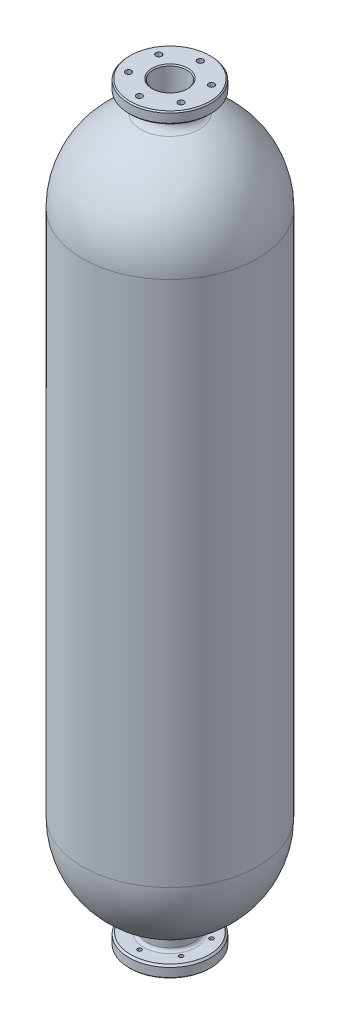
from build123d import *

# Parameters (mm, degrees)
CIRPATTERN1_COUNT = 6


with BuildPart() as part:
    # Sketch2 → Revolve1 (revolve)
    with BuildSketch(Plane.XY, mode=Mode.PRIVATE) as revolve1_sk:
        with BuildLine():
            Line((-150, 450.5), (-150, -450.5))
            ThreePointArc((-150, -450.5), (-122.474487139, -537.102540378), (-50, -591.921356237))
            ThreePointArc((-50, -591.921356237), (-42.752551286, -597.403237823), (-40, -606.063491861))
            Line((-40, -606.063491861), (-40, -617.5))
            ThreePointArc((-40, -617.5), (-41.464466094, -621.035533906), (-45, -622.5))
            Line((-45, -622.5), (-67, -622.5))
            Line((-67, -622.5), (-70, -625.5))
            Line((-70, -625.5), (-70, -640.5))
            Line((-70, -640.5), (-68, -642.5))
            Line((-68, -642.5), (-40, -642.5))
            Line((-40, -642.5), (0, -642.5))
            Line((0, -642.5), (0, -592.5))
            ThreePointArc((0, -592.5), (-100.409162928, -550.909162928), (-142, -450.5))
            Line((-142, -450.5), (-142, 450.5))
            ThreePointArc((-142, 450.5), (-100.409162928, 550.909162928), (0, 592.5))
            Line((0, 592.5), (0, 642.5))
            Line((0, 642.5), (-40, 642.5))
            Line((-40, 642.5), (-68, 642.5))
            Line((-68, 642.5), (-70, 640.5))
            Line((-70, 640.5), (-70, 625.5))
            Line((-70, 625.5), (-67, 622.5))
            Line((-67, 622.5), (-45, 622.5))
            ThreePointArc((-45, 622.5), (-41.464466094, 621.035533906), (-40, 617.5))
            Line((-40, 617.5), (-40, 606.063491861))
            ThreePointArc((-40, 606.063491861), (-42.752551286, 597.403237823), (-50, 591.921356237))
            ThreePointArc((-50, 591.921356237), (-122.474487139, 537.102540378), (-150, 450.5))
        make_face()
    revolve(revolve1_sk.sketch.rotate(Axis((0, 415.469849099, 0), (0, -1, 0)), 270), axis=Axis((0, 415.469849099, 0), (0, -1, 0)))

    # Sketch7 → 3/8 Clearance Hole1 (revolve, cut)
    with BuildSketch(Plane(origin=(0, 642.5, -52), x_dir=(0, 0, 1), z_dir=(1, 0, 0))):
        Polygon((0, 0), (0, 22.079479155), (5.0419, 19.05), (5.0419, 0), align=None)
    f_3_8_clearance_hole1 = revolve(axis=Axis((0, 648.85, -52), (0, -1, 0)), mode=Mode.SUBTRACT)

    # CirPattern1: 3/8 Clearance Hole1 ×6 about axis
    cirpattern1_axis = Axis((0, 0, 0), (0, 1, 0))
    for i in range(1, CIRPATTERN1_COUNT):
        add(f_3_8_clearance_hole1.rotate(cirpattern1_axis, i * 360 / CIRPATTERN1_COUNT), mode=Mode.SUBTRACT)

    # Sketch8 → 2-11-1/2 NPSM Tapped Hole1 (revolve, cut)
    with BuildSketch(Plane(origin=(0, 642.5, 0), x_dir=(0, 0, 1), z_dir=(1, 0, 0))):
        Polygon((0, 0), (0, 209.238270557), (28.6893, 192), (28.6893, 1.8034), (30.4927, 0), align=None)
    f_2_11_1_2_npsm_tapped_hole1 = revolve(axis=Axis((0, 648.85, 0), (0, -1, 0)), mode=Mode.SUBTRACT)

    # Mirror2: 3/8 Clearance Hole1 across plane
    add(f_3_8_clearance_hole1.mirror(Plane.ZX), mode=Mode.SUBTRACT)

    # Mirror2 copy 1 sketch → Mirror2 copy 1 (revolve, cut)
    with BuildSketch(Plane(origin=(-45.033320997, -642.5, -26), x_dir=(0.8660254037844386, 0, 0.5000000000000001), z_dir=(0.5000000000000001, 0, -0.8660254037844386))):
        Polygon((0, 0), (0, -22.079479155), (5.0419, -19.05), (5.0419, 0), align=None)
    revolve(axis=Axis((-45.033320997, -648.85, -26), (0, -1, 0)), mode=Mode.SUBTRACT)

    # Mirror2 copy 2 sketch → Mirror2 copy 2 (revolve, cut)
    with BuildSketch(Plane(origin=(-45.033320997, -642.5, 26), x_dir=(0.8660254037844387, 0, -0.4999999999999998), z_dir=(-0.4999999999999998, 0, -0.8660254037844387))):
        Polygon((0, 0), (0, -22.079479155), (5.0419, -19.05), (5.0419, 0), align=None)
    revolve(axis=Axis((-45.033320997, -648.85, 26), (0, -1, 0)), mode=Mode.SUBTRACT)

    # Mirror2 copy 3 sketch → Mirror2 copy 3 (revolve, cut)
    with BuildSketch(Plane(origin=(0, -642.5, 52), x_dir=(0, 0, -1), z_dir=(-1, 0, 0))):
        Polygon((0, 0), (0, -22.079479155), (5.0419, -19.05), (5.0419, 0), align=None)
    revolve(axis=Axis((0, -648.85, 52), (0, -1, 0)), mode=Mode.SUBTRACT)

    # Mirror2 copy 4 sketch → Mirror2 copy 4 (revolve, cut)
    with BuildSketch(Plane(origin=(45.033320997, -642.5, 26), x_dir=(-0.8660254037844384, 0, -0.5000000000000004), z_dir=(-0.5000000000000004, 0, 0.8660254037844384))):
        Polygon((0, 0), (0, -22.079479155), (5.0419, -19.05), (5.0419, 0), align=None)
    revolve(axis=Axis((45.033320997, -648.85, 26), (0, -1, 0)), mode=Mode.SUBTRACT)

    # Mirror2 copy 5 sketch → Mirror2 copy 5 (revolve, cut)
    with BuildSketch(Plane(origin=(45.033320997, -642.5, -26), x_dir=(-0.8660254037844386, 0, 0.5000000000000001), z_dir=(0.5000000000000001, 0, 0.8660254037844386))):
        Polygon((0, 0), (0, -22.079479155), (5.0419, -19.05), (5.0419, 0), align=None)
    revolve(axis=Axis((45.033320997, -648.85, -26), (0, -1, 0)), mode=Mode.SUBTRACT)

    # Mirror3: 2-11-1/2 NPSM Tapped Hole1 across plane
    add(f_2_11_1_2_npsm_tapped_hole1.mirror(Plane.ZX), mode=Mode.SUBTRACT)


solid = part.part
